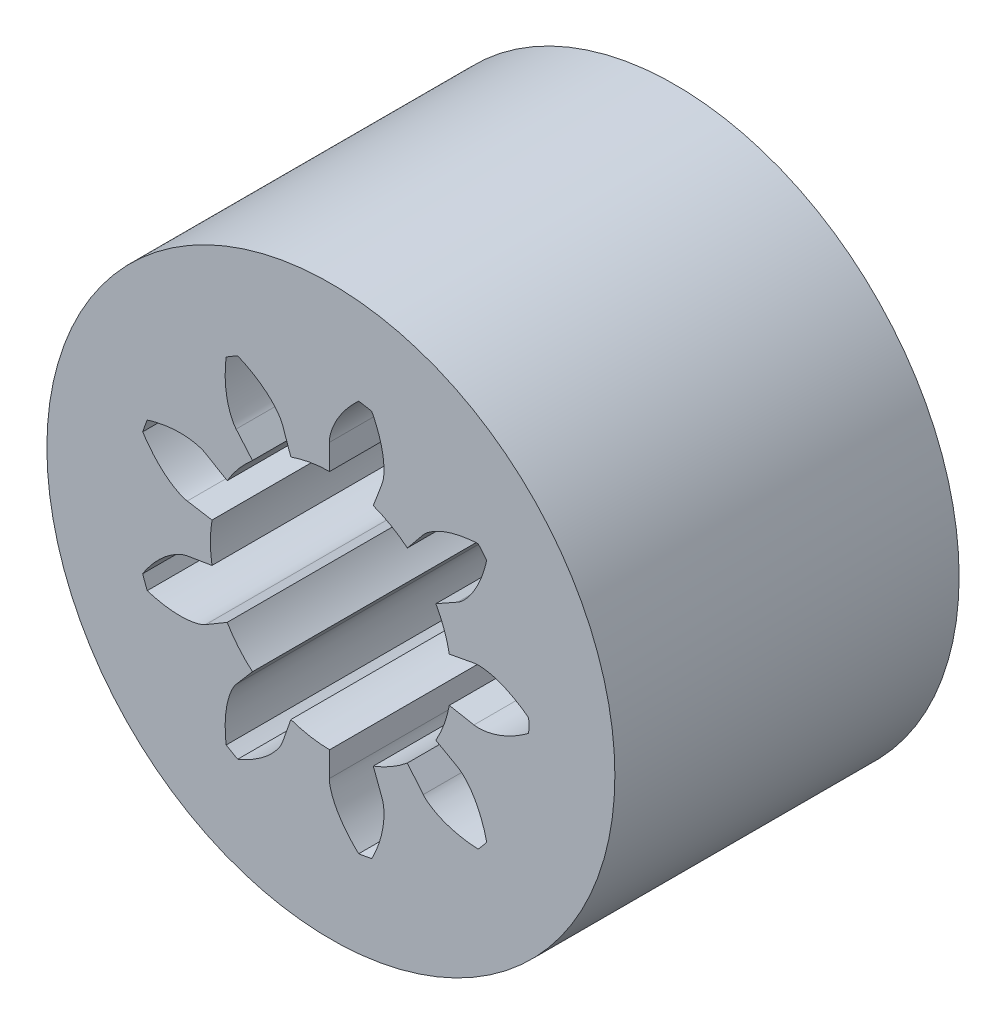
from build123d import *

# Parameters (mm, degrees)
SKETCH_1_R               = 3.3
SKETCH_1_R_2             = 1.4
EXTRUDE_1_DEPTH          = 4
CUT_EXTRUDE_2_DEPTH      = 7.146543744
PATTERN_CIRCULAR_1_COUNT = 9


with BuildPart() as part:
    # 草图1 → 凸台-拉伸1 (new body)
    with BuildSketch(Plane.XY):
        Circle(SKETCH_1_R)
        Circle(SKETCH_1_R_2, mode=Mode.SUBTRACT)
    extrude(amount=EXTRUDE_1_DEPTH)

    # 草图1<3> → 切除-拉伸2 (cut, through all)
    with BuildSketch(Plane.XY):
        with BuildLine():
            Line((1.662533824, 0.311405332), (1.376068977, 0.25774827))
            ThreePointArc((1.376068977, 0.25774827), (1.394004406, 0.129428421), (1.4, 0))
            ThreePointArc((1.4, 0), (1.394004406, -0.129428421), (1.376068977, -0.25774827))
            Line((1.376068977, -0.25774827), (1.662533824, -0.311405332))
            add(Edge.make_bspline(
                [(1.662533824, -0.311405332), (1.675205333, -0.313778803), (1.711083832, -0.317659393), (1.780190094, -0.314430955), (1.890417179, -0.293797665), (2.027621966, -0.245157179), (2.149610149, -0.181207231), (2.236923472, -0.123298158), (2.286284468, -0.086512346), (2.298711222, -0.076985185)],
                knots=[0, 0, 0, 0, 0, 0.005604068, 0.015718248, 0.029959916, 0.048733667, 0.068727063, 0.075548145, 0.075548145, 0.075548145, 0.075548145, 0.075548145], degree=4))
            ThreePointArc((2.298711222, -0.076985185), (2.299677783, -0.038497986), (2.3, 0))
            ThreePointArc((2.3, 0), (2.299677783, 0.038497986), (2.298711222, 0.076985185))
            add(Edge.make_bspline(
                [(1.662533824, 0.311405332), (1.675205333, 0.313778803), (1.711083832, 0.317659393), (1.780190094, 0.314430955), (1.890417179, 0.293797665), (2.027621966, 0.245157179), (2.149610149, 0.181207231), (2.236923472, 0.123298158), (2.286284468, 0.086512346), (2.298711222, 0.076985185)],
                knots=[0, 0, 0, 0, 0, 0.005604068, 0.015718248, 0.029959916, 0.048733667, 0.068727063, 0.075548145, 0.075548145, 0.075548145, 0.075548145, 0.075548145], degree=4))
        make_face()
    cut_extrude_2 = extrude(amount=CUT_EXTRUDE_2_DEPTH, mode=Mode.SUBTRACT)

    # 阵列(圆周)1: 切除-拉伸2 ×9 about axis
    pattern_circular_1_axis = Axis((0, 0, 4), (0, 0, 1))
    for i in range(1, PATTERN_CIRCULAR_1_COUNT):
        add(cut_extrude_2.rotate(pattern_circular_1_axis, i * 360 / PATTERN_CIRCULAR_1_COUNT), mode=Mode.SUBTRACT)


solid = part.part
